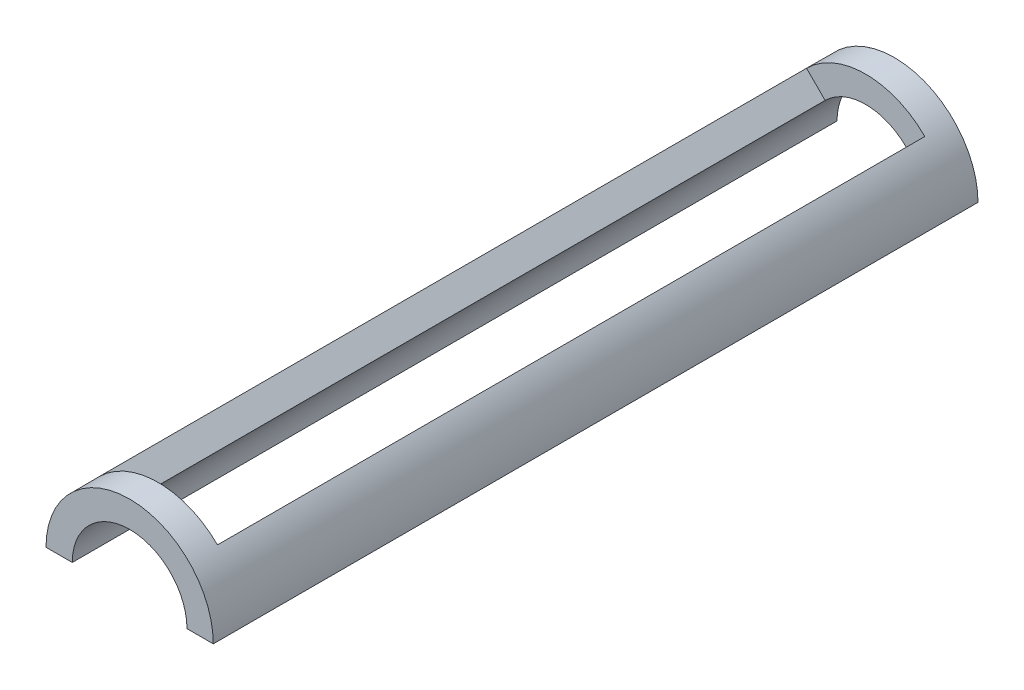
from build123d import *

# Parameters (mm, degrees)
BOSS_EXTRUDE1_DEPTH = 80
CUT_EXTRUDE3_DEPTH  = 74


with BuildPart() as part:
    # Sketch1 → Boss-Extrude1 (new, symmetric)
    with BuildSketch(Plane.XY):
        with BuildLine():
            Line((17.5, 0), (12, 0))
            ThreePointArc((12, 0), (0, 12), (-12, 0))
            Line((-12, 0), (-17.5, 0))
            ThreePointArc((-17.5, 0), (0, 17.5), (17.5, 0))
        make_face()
    extrude(amount=BOSS_EXTRUDE1_DEPTH, both=True)

    # Sketch4 → Cut-Extrude3 (cut, symmetric)
    with BuildSketch(Plane.XY):
        with BuildLine():
            Line((0, 0), (12.374368671, 12.374368671))
            ThreePointArc((12.374368671, 12.374368671), (0, 17.5), (-12.374368671, 12.374368671))
            Line((-12.374368671, 12.374368671), (0, 0))
        make_face()
    extrude(amount=CUT_EXTRUDE3_DEPTH, both=True, mode=Mode.SUBTRACT)


solid = part.part
